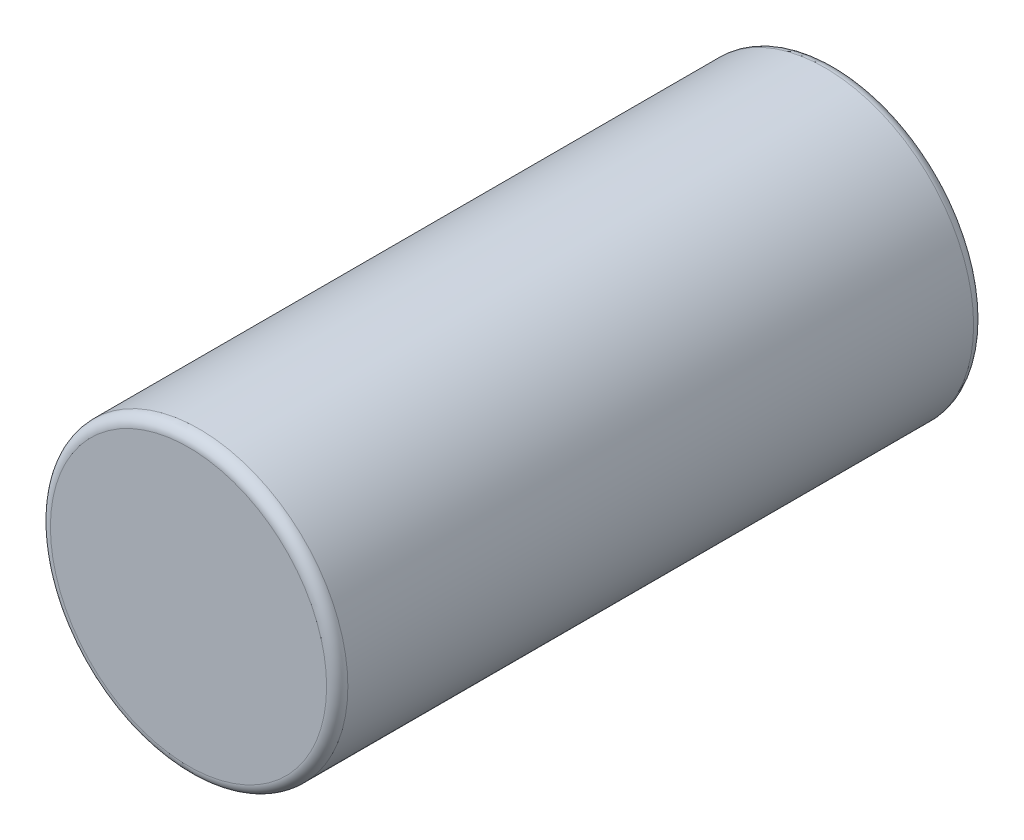
from build123d import *


with BuildPart() as part:
    # Sketch1 → Revolve1 (revolve)
    with BuildSketch(Plane(origin=(0, 0, 0), x_dir=(0, 0, -1), z_dir=(1, 0, 0)), mode=Mode.PRIVATE) as revolve1_sk:
        with BuildLine():
            Line((0, 0), (0, 6.5))
            ThreePointArc((0, 6.5), (0.146446609, 6.853553391), (0.5, 7))
            Line((0.5, 7), (29.95, 7))
            ThreePointArc((29.95, 7), (30.303553391, 6.853553391), (30.45, 6.5))
            Line((30.45, 6.5), (30.45, 0))
            Line((30.45, 0), (0, 0))
        make_face()
    revolve(revolve1_sk.sketch.rotate(Axis((0, 0, 0), (0, 0, -1)), 90), axis=Axis((0, 0, 0), (0, 0, -1)))


solid = part.part
